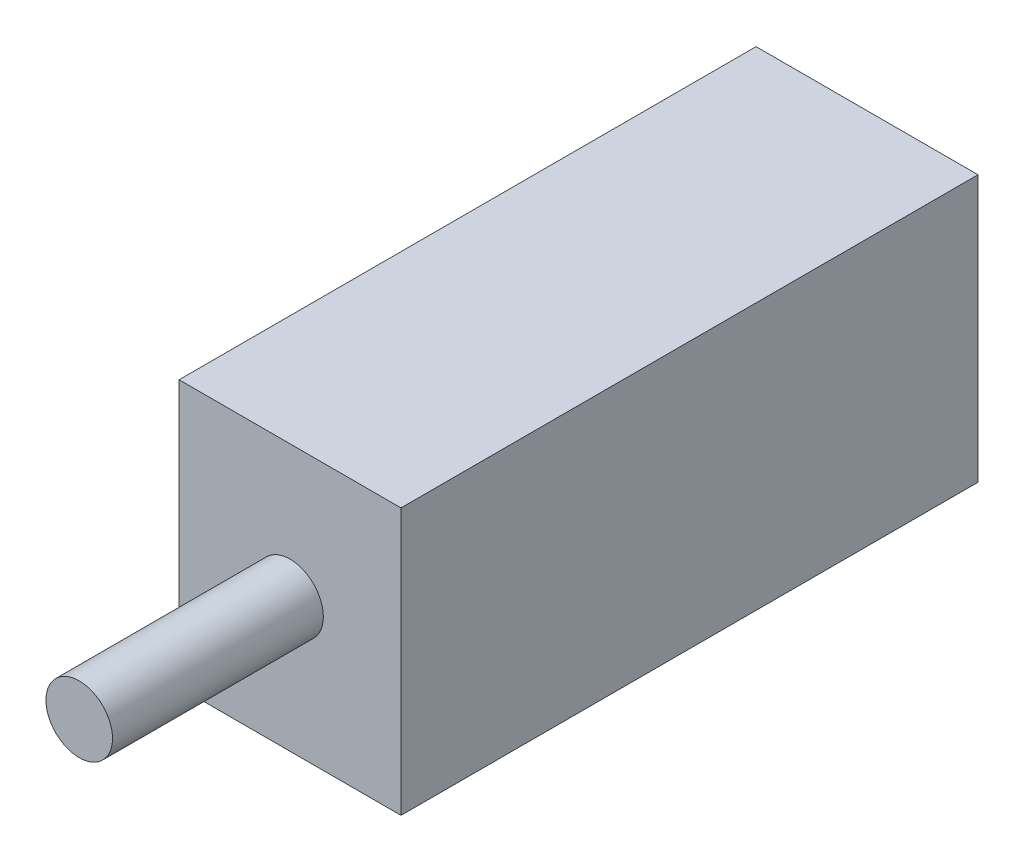
from build123d import *

# Parameters (mm, degrees)
SKETCH2_W           = 10
SKETCH2_H           = 12
BOSS_EXTRUDE1_DEPTH = 26
SKETCH3_R           = 1.5
BOSS_EXTRUDE2_DEPTH = 9.5


with BuildPart() as part:
    # Sketch2 → Boss-Extrude1 (new body)
    with BuildSketch(Plane.XY):
        with Locations((5, 6)):
            Rectangle(SKETCH2_W, SKETCH2_H)
    extrude(amount=BOSS_EXTRUDE1_DEPTH)

    # Sketch3 → Boss-Extrude2 (add)
    with BuildSketch(Plane.XY.offset(26)):
        with Locations((5, 6)):
            Circle(SKETCH3_R)
    extrude(amount=BOSS_EXTRUDE2_DEPTH)


solid = part.part
